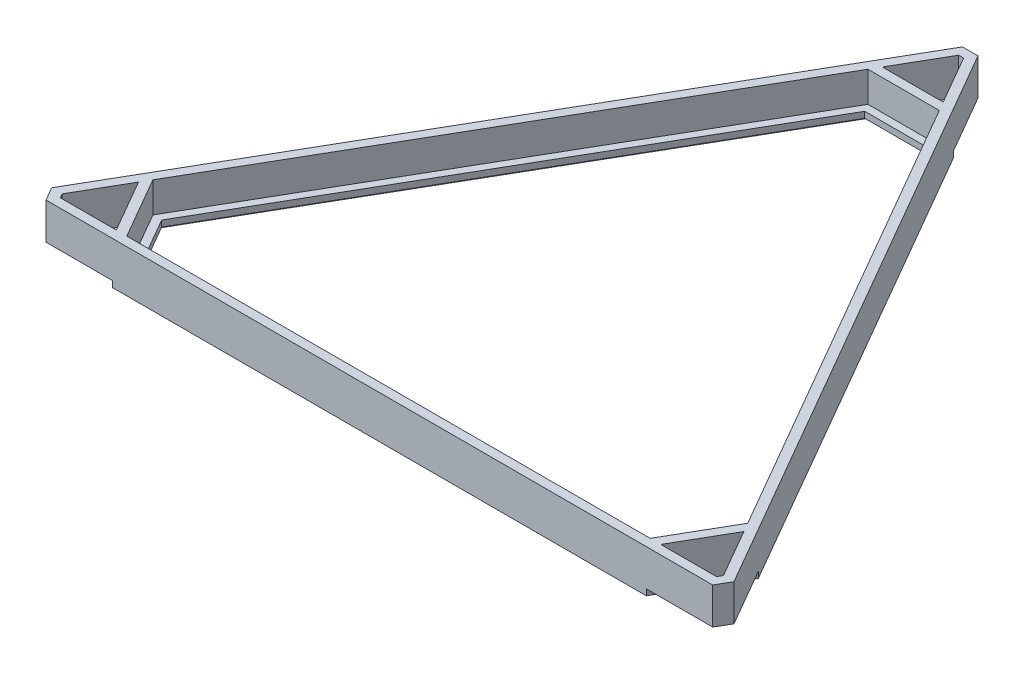
from build123d import *

# Parameters (mm, degrees)
BOSS_EXTRUDE1_DEPTH = 12
BOSS_EXTRUDE2_DEPTH = 2
BOSS_EXTRUDE3_DEPTH = 2


with BuildPart() as part:
    # Sketch1 → Boss-Extrude1 (new body)
    with BuildSketch(Plane(origin=(0, 0, 0), x_dir=(1, 0, 0), z_dir=(0, 1, 0))):
        Polygon((109.556624327, -4.42820323), (-109.556624327, -4.42820323), (-112.113248654, 0), (-2.556624327, 189.75763964), (2.556624327, 189.75763964), (112.113248654, 0), align=None)
        Polygon((-107.824573519, -1.42820323), (-108.649147039, 0), (-99.473720558, 15.892304845), (-89.473720558, -1.42820323), align=None, mode=Mode.SUBTRACT)
        Polygon((-0.824573519, 186.75763964), (0.824573519, 186.75763964), (10, 170.865334795), (-10, 170.865334795), align=None, mode=Mode.SUBTRACT)
        Polygon((108.649147039, 0), (107.824573519, -1.42820323), (89.473720558, -1.42820323), (99.473720558, 15.892304845), align=None, mode=Mode.SUBTRACT)
        Polygon((-11.732050808, 167.865334795), (11.732050808, 167.865334795), (97.741669751, 18.892304845), (86.009618943, -1.42820323), (-86.009618943, -1.42820323), (-97.741669751, 18.892304845), align=None, mode=Mode.SUBTRACT)
    extrude(amount=BOSS_EXTRUDE1_DEPTH)

    # Sketch1<4> → Boss-Extrude2 (add)
    with BuildSketch(Plane(origin=(0, 0, 0), x_dir=(1, 0, 0), z_dir=(0, 1, 0))):
        Polygon((11.732050808, 167.865334795), (-11.732050808, 167.865334795), (-97.741669751, 18.892304845), (-86.009618943, -1.42820323), (86.009618943, -1.42820323), (97.741669751, 18.892304845), align=None)
        Polygon((84.56624327, 1.07179677), (-84.56624327, 1.07179677), (-94.854918405, 18.892304845), (-10.288675135, 165.365334795), (10.288675135, 165.365334795), (94.854918405, 18.892304845), align=None, mode=Mode.SUBTRACT)
    extrude(amount=BOSS_EXTRUDE2_DEPTH)

    # Sketch2 → Boss-Extrude3 (add)
    with BuildSketch(Plane.XZ):
        Polygon((101.205771366, -18.892304845), (87.741669751, 4.42820323), (-87.741669751, 4.42820323), (-101.205771366, -18.892304845), (-13.464101615, -170.865334795), (13.464101615, -170.865334795), align=None)
        Polygon((-11.732050807, -167.865334795), (11.732050807, -167.865334795), (97.741669751, -18.892304845), (86.009618943, 1.42820323), (-86.009618943, 1.42820323), (-97.741669751, -18.892304845), align=None, mode=Mode.SUBTRACT)
    extrude(amount=BOSS_EXTRUDE3_DEPTH)


solid = part.part
